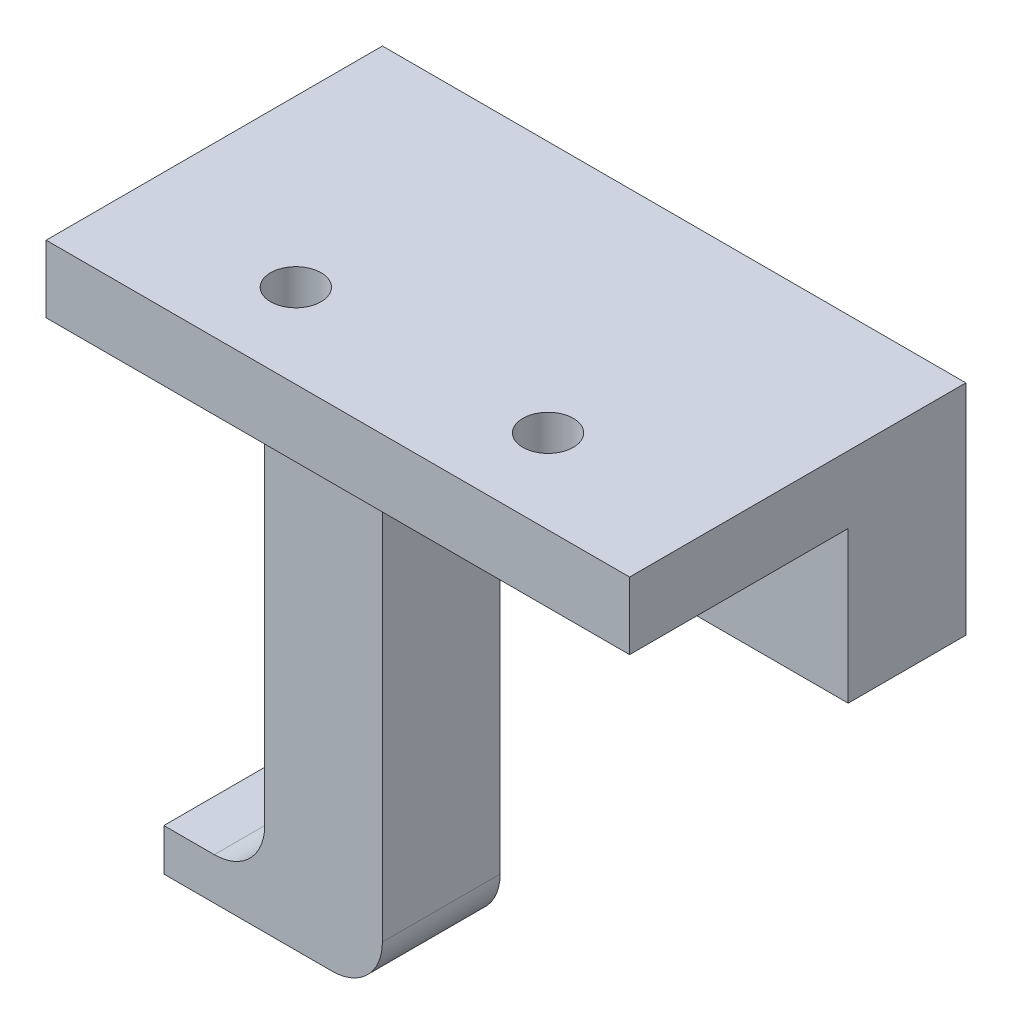
from build123d import *

# Parameters (mm, degrees)
BOSS_EXTRUDE1_DEPTH = 7
FILLET1_R           = 3
SKETCH3_W           = 34.7
SKETCH3_H           = 20
SKETCH3_R           = 1.5
BOSS_EXTRUDE2_DEPTH = 4


with BuildPart() as part:
    # Sketch1 → Boss-Extrude1 (new body)
    with BuildSketch(Plane.XY):
        Polygon((7, 0), (34.7, 0), (34.7, 9), (0, 9), (0, 0), (0, -26.65), (-6, -26.65), (-6, -29.15), (0, -29.15), (7, -29.15), align=None)
    extrude(amount=BOSS_EXTRUDE1_DEPTH)

    # Fillet1
    fillet1_edges = [part.edges().sort_by_distance(p)[0] for p in [
        (7, 0, 3.5),
        (7, -29.15, 3.5),
        (0, -26.65, 3.5),
    ]]
    fillet(fillet1_edges, radius=FILLET1_R)

    # Sketch3 → Boss-Extrude2 (add)
    with BuildSketch(Plane(origin=(0, 9, 0), x_dir=(1, 0, 0), z_dir=(0, 1, 0))):
        with Locations((17.35, -10)):
            Rectangle(SKETCH3_W, SKETCH3_H)
        with Locations(Location((24.85, -15, 0), (0, 0, 270))):
            Circle(SKETCH3_R, mode=Mode.SUBTRACT)
        with Locations(Location((9.85, -15, 0), (0, 0, 270))):
            Circle(SKETCH3_R, mode=Mode.SUBTRACT)
    extrude(amount=BOSS_EXTRUDE2_DEPTH)


solid = part.part
